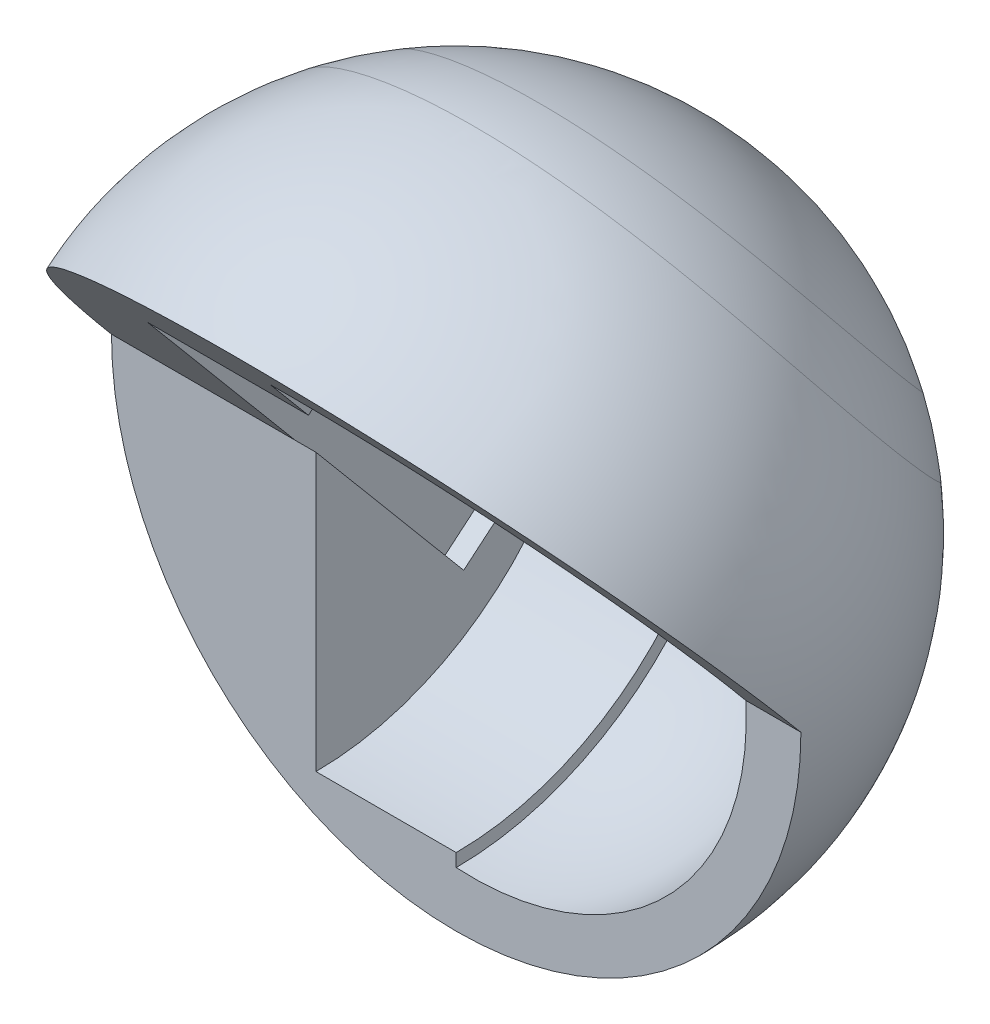
from build123d import *

# Parameters (mm, degrees)
REVOLVE4_ANGLE     = 220
CUT_REVOLVE1_ANGLE = 234
SKETCH11_W         = 8.89
SKETCH11_H         = 25.4
CUT_EXTRUDE3_DEPTH = 10.16
SKETCH12_W         = 7.749397949
SKETCH12_H         = 15.281133174
CUT_REVOLVE2_ANGLE = 59


with BuildPart() as part:
    # Sketch3 → Revolve4 (revolve)
    with BuildSketch(Plane.XY):
        with BuildLine():
            ThreePointArc((0, -19.05), (13.470384182, -13.470384182), (19.05, 0))
            Line((19.05, 0), (-19.05, 0))
            ThreePointArc((-19.05, 0), (-13.470384182, -13.470384182), (0, -19.05))
        make_face()
    revolve(axis=Axis((19.05, 0, 0), (1, 0, 0)), revolution_arc=REVOLVE4_ANGLE)

    # Sketch10 → Cut-Revolve1 (revolve, cut)
    with BuildSketch(Plane(origin=(0, 0, 0), x_dir=(1, 0, 0), z_dir=(0, -0.6427876096865458, 0.7660444431189727))):
        with BuildLine():
            Line((0, 0), (0, 16.002))
            ThreePointArc((0, 16.002), (11.594580028, 11.594580028), (16.002, 0))
            Line((16.002, 0), (0, 0))
        make_face()
    revolve(axis=Axis((0, 0, 0), (-1, 0, 0)), revolution_arc=CUT_REVOLVE1_ANGLE, mode=Mode.SUBTRACT)

    # Sketch11 → Cut-Extrude3 (cut)
    with BuildSketch(Plane(origin=(0, 0, 0), x_dir=(1, 0, 0), z_dir=(0, -0.6427876096865458, 0.7660444431189727))):
        with Locations((-4.445, 0)):
            Rectangle(SKETCH11_W, SKETCH11_H)
    extrude(amount=-CUT_EXTRUDE3_DEPTH, mode=Mode.SUBTRACT)

    # Sketch12 → Cut-Revolve2 (revolve, cut)
    with BuildSketch(Plane.XY):
        with Locations((-3.874698975, -7.640566587)):
            Rectangle(SKETCH12_W, SKETCH12_H)
    revolve(axis=Axis((19.05, 0, 0), (1, 0, 0)), revolution_arc=CUT_REVOLVE2_ANGLE, mode=Mode.SUBTRACT)


solid = part.part
